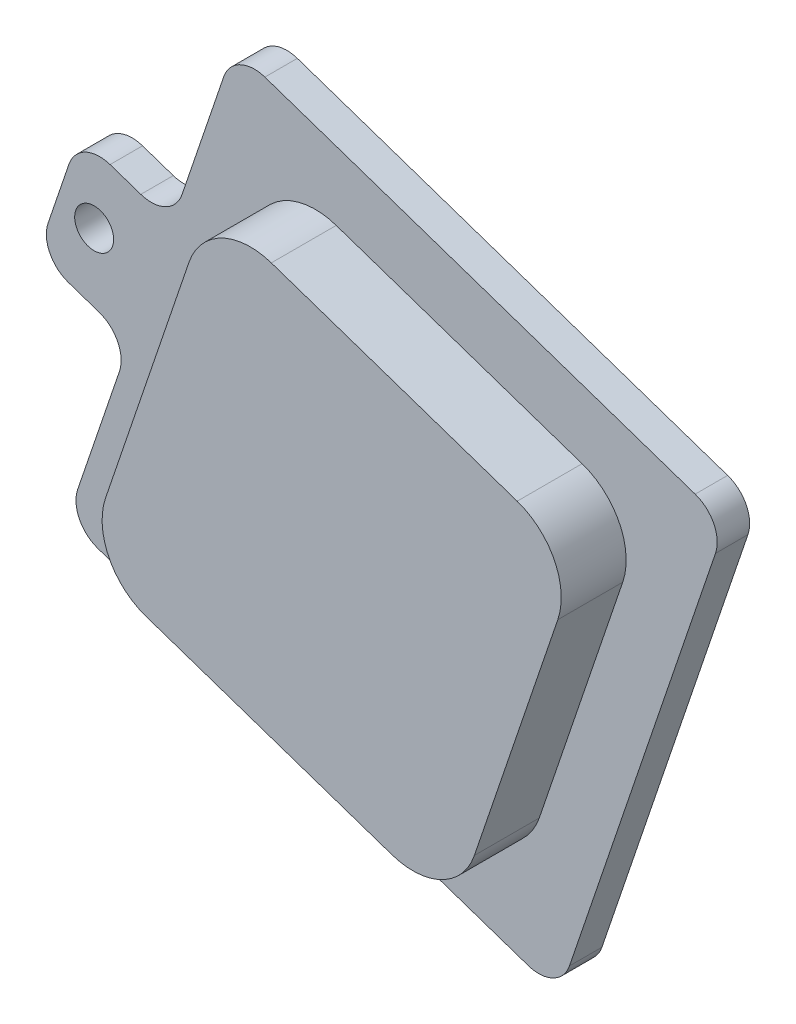
from build123d import *

# Parameters (mm, degrees)
BOSS_EXTRUDE1_DEPTH    = 3.175
CUT_EXTRUDE1_DEPTH     = 66.066884919
CUT_EXTRUDE2_DEPTH     = 65.107450137
BOSS_EXTRUDE2_DEPTH    = 6.35
M3_5_CLEARANCE_HOLE1_D = 3.81
FILLET1_R              = 3.175
FILLET2_R              = 6.35


with BuildPart() as part:
    # Sketch1 → Boss-Extrude1 (new body)
    with BuildSketch(Plane.XY.offset(3.175)):
        Polygon((54.97356176, 15.279413628), (-2.152444785, 34.663040771), (-18.475499222, -13.443070004), (38.650507323, -32.826697147), align=None)
    extrude(amount=-BOSS_EXTRUDE1_DEPTH)

    # Sketch2 → Cut-Extrude1 (cut, through all)
    with BuildSketch(Plane(origin=(0, 0, 0), x_dir=(-1, 0, 0), z_dir=(0, 0, -1))):
        Polygon((2.152444785, 34.663040771), (-6.867450985, 31.602468064), (-0.746305571, 13.562676524), (8.273590199, 16.62324923), align=None)
    extrude(amount=-CUT_EXTRUDE1_DEPTH, mode=Mode.SUBTRACT)

    # Sketch3 → Cut-Extrude2 (cut, through all)
    with BuildSketch(Plane(origin=(0, 0, 0), x_dir=(-1, 0, 0), z_dir=(0, 0, -1))):
        Polygon((18.475499222, -13.443070004), (12.354353808, 4.596721537), (3.334458038, 1.53614883), (9.455603451, -16.503642711), align=None)
    extrude(amount=-CUT_EXTRUDE2_DEPTH, mode=Mode.SUBTRACT)

    # Sketch4 → Boss-Extrude2 (add)
    with BuildSketch(Plane.XY.offset(3.175)):
        Polygon((46.919916108, 11.306531586), (34.677625281, -24.773051496), (-1.4019578, -12.530760668), (10.840333027, 23.548822413), align=None)
    extrude(amount=BOSS_EXTRUDE2_DEPTH)

    # M3.5 Clearance Hole1 (through all)
    with Locations(Plane.XY.offset(3.175)):
        with Locations((-6.826278972, 9.426563937)):
            Hole(M3_5_CLEARANCE_HOLE1_D / 2)

    # Fillet1
    fillet1_edges = [part.edges().sort_by_distance(p)[0] for p in [
        (-8.273590199, 16.62324923, 1.5875),
        (0.746305571, 13.562676524, 1.5875),
        (6.867450985, 31.602468064, 1.5875),
        (-9.455603451, -16.503642711, 1.5875),
        (-3.334458038, 1.53614883, 1.5875),
        (-12.354353808, 4.596721537, 1.5875),
        (38.650507323, -32.826697147, 1.5875),
        (54.97356176, 15.279413628, 1.5875),
    ]]
    fillet(fillet1_edges, radius=FILLET1_R)

    # Fillet2
    fillet2_edges = [part.edges().sort_by_distance(p)[0] for p in [
        (46.919916108, 11.306531586, 6.35),
        (10.840333027, 23.548822413, 6.35),
        (-1.4019578, -12.530760668, 6.35),
        (34.677625281, -24.773051496, 6.35),
    ]]
    fillet(fillet2_edges, radius=FILLET2_R)


solid = part.part
